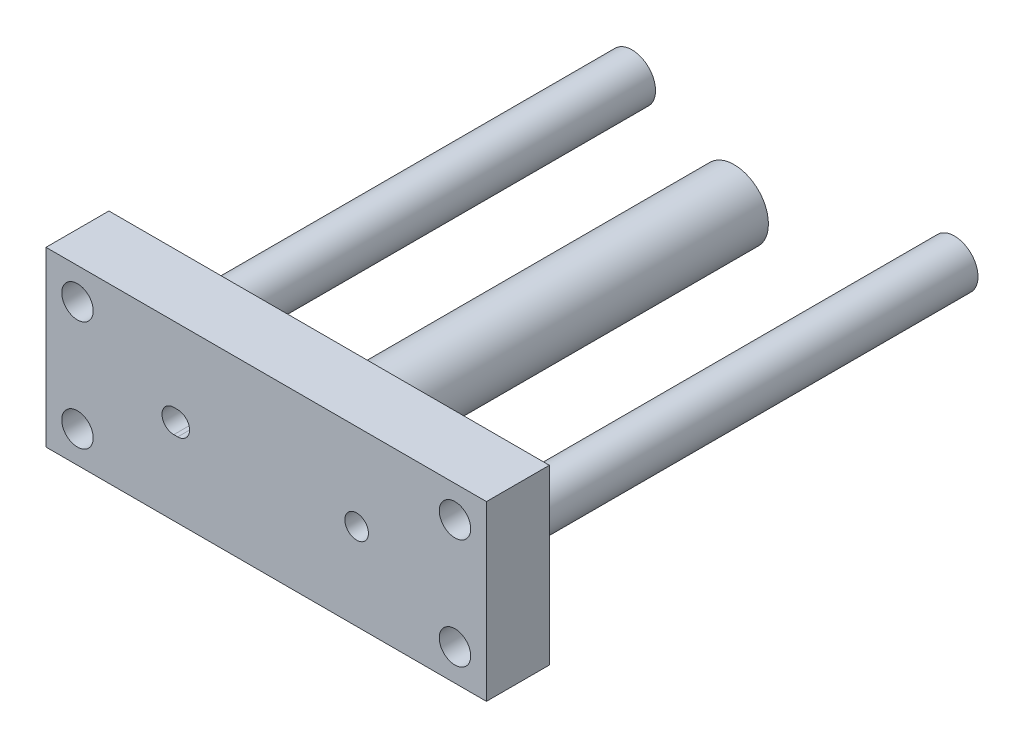
from build123d import *

# Parameters (mm, degrees)
SKETCH_4_R               = 3
EXTRUDE_1_DEPTH          = 54
CUT_EXTRUDE_1_DEPTH      = 63.657800791
SKETCH_6_R               = 4
CUT_EXTRUDE_2_DEPTH      = 4.5
SKETCH_7_R               = 2.25
CUT_EXTRUDE_3_DEPTH      = 21.5
EXTRUDE_2_DEPTH          = 54
SKETCH_9_R               = 2.5
CUT_EXTRUDE_4_DEPTH      = 5
SKETCH_10_R              = 2.5
CUT_EXTRUDE_5_DEPTH      = 5
SKETCH_11_R              = 4.35
CUT_EXTRUDE_6_DEPTH      = 46.5
SKETCH_12_R              = 1.5
CUT_EXTRUDE_7_DEPTH      = 3
SKETCH_13_R              = 1.5
EXTRUDE_4_DEPTH          = 3
SKETCH_14_R              = 1.5
CUT_EXTRUDE_8_DEPTH      = 6
CUT_EXTRUDE_9_DEPTH      = 3
EXTRUDE_START            = 5
SKETCH_16_W              = 56
SKETCH_16_H              = 22
EXTRUDE_5_DEPTH          = 8
SKETCH_18_R              = 3
EXTRUDE_6_DEPTH          = 67
SKETCH_19_R              = 4.35
EXTRUDE_7_DEPTH          = 59.5
SKETCH_20_R              = 2
CUT_EXTRUDE_10_DEPTH     = 8
MIRROR_4_COPY_1_SKETCH_R = 2
MIRROR_4_COPY_1_DEPTH    = 8
CUT_EXTRUDE_START        = -3
SKETCH_21_R              = 1.5
CUT_EXTRUDE_11_DEPTH     = 3
SKETCH_22_R              = 1.5
CUT_EXTRUDE_12_DEPTH     = 3


with BuildPart() as part:
    # 草图4 → 凸台-拉伸1 (new body)
    with BuildSketch(Plane.XY):
        Polygon((-14.75, -7), (-16.25, -7), (-16.25, -6.5), (-20.75, -6.5), (-20.75, -7), (-22.25, -7), (-22.25, -11), (-20.75, -11), (-20.75, -13), (-29, -13), (-29, 13), (-23, 13), (-20.6, 10.6), (-19.1, 10.6), (-16.7, 13), (0, 13), (0, -13), (-16.25, -13), (-16.25, -11), (-14.75, -11), align=None)
        with Locations((-20.5, 0)):
            Circle(SKETCH_4_R, mode=Mode.SUBTRACT)
    extrude(amount=-EXTRUDE_1_DEPTH)

    # 草图5 → 切除-拉伸1 (cut, through all)
    with BuildSketch(Plane.XY):
        Polygon((-5.5, -12), (-4.5, -12), (-4.5, -13), (-2.25, -13), (-2.25, -12), (-1.25, -12), (-1.25, -10), (-5.5, -10), align=None)
    cut_extrude_1 = extrude(amount=-CUT_EXTRUDE_1_DEPTH, mode=Mode.SUBTRACT)

    # 镜向1: 切除-拉伸1 across plane
    add(cut_extrude_1.mirror(Plane.ZX), mode=Mode.SUBTRACT)

    # 草图6 → 切除-拉伸2 (cut)
    with BuildSketch(Plane(origin=(0, 13, 0), x_dir=(-1, 0, 0), z_dir=(0, 1, 0))):
        with Locations(Location((11.5, -25, 0), (0, 0, 90))):
            Circle(SKETCH_6_R)
        with Locations(Location((11.5, -5, 0), (0, 0, 90))):
            Circle(SKETCH_6_R)
    extrude(amount=-CUT_EXTRUDE_2_DEPTH, mode=Mode.SUBTRACT)

    # 草图7 → 切除-拉伸3 (cut)
    with BuildSketch(Plane(origin=(0, 8.5, 0), x_dir=(1, 0, 0), z_dir=(0, 1, 0))):
        with Locations(Location((-11.5, 25, 0), (0, 0, 270))):
            Circle(SKETCH_7_R)
        with Locations(Location((-11.5, 5, 0), (0, 0, 270))):
            Circle(SKETCH_7_R)
    extrude(amount=-CUT_EXTRUDE_3_DEPTH, mode=Mode.SUBTRACT)

    # 镜向2: part across plane


with BuildPart() as part_1:
    add(part.part)
    add(part.part.mirror(Plane(origin=(0, 0, 0), x_dir=(0, 0, 1), z_dir=(1, 0, 0))))

    # 草图8 → 凸台-拉伸2 (add)
    with BuildSketch(Plane.XY):
        Polygon((16.7, 13), (23, 13), (20.6, 10.6), (19.1, 10.6), align=None)
    extrude(amount=-EXTRUDE_2_DEPTH)

    # 草图9 → 切除-拉伸4 (cut)
    with BuildSketch(Plane(origin=(0, 13, 0), x_dir=(1, 0, 0), z_dir=(0, 1, 0))):
        with Locations(Location((18, 46.5, 0), (0, 0, 270))):
            Circle(SKETCH_9_R)
        with Locations(Location((18, 11, 0), (0, 0, 270))):
            Circle(SKETCH_9_R)
    extrude(amount=-CUT_EXTRUDE_4_DEPTH, mode=Mode.SUBTRACT)

    # 草图10 → 切除-拉伸5 (cut)
    with BuildSketch(Plane(origin=(29, 0, 0), x_dir=(0, 0, -1), z_dir=(1, 0, 0))):
        with Locations((11, 8)):
            Circle(SKETCH_10_R)
        with Locations((38.5, 8)):
            Circle(SKETCH_10_R)
    extrude(amount=-CUT_EXTRUDE_5_DEPTH, mode=Mode.SUBTRACT)

    # 草图11 → 切除-拉伸6 (cut)
    with BuildSketch(Plane.XY):
        Circle(SKETCH_11_R)
    extrude(amount=-CUT_EXTRUDE_6_DEPTH, mode=Mode.SUBTRACT)

    # 草图12 → 切除-拉伸7 (cut)
    with BuildSketch(Plane(origin=(0, 0, -54), x_dir=(-1, 0, 0), z_dir=(0, 0, -1))):
        with Locations((-11.5, 0)):
            Circle(SKETCH_12_R)
        with BuildLine():
            Line((11.75, 1.5), (11.25, 1.5))
            ThreePointArc((11.25, 1.5), (9.75, 0), (11.25, -1.5))
            Line((11.25, -1.5), (11.75, -1.5))
            ThreePointArc((11.75, -1.5), (13.25, 0), (11.75, 1.5))
        make_face()
    extrude(amount=-CUT_EXTRUDE_7_DEPTH, mode=Mode.SUBTRACT)

    # 草图13 → 凸台-拉伸4 (add)
    with BuildSketch(Plane(origin=(0, 0, -51), x_dir=(-1, 0, 0), z_dir=(0, 0, -1))):
        with Locations((11.5, 0)):
            Circle(SKETCH_13_R)
        with Locations((-11.5, 0)):
            Circle(SKETCH_13_R)
    extrude(amount=-EXTRUDE_4_DEPTH)

    # 草图14 → 切除-拉伸8 (cut)
    with BuildSketch(Plane.XZ.offset(13)):
        with Locations(Location((-11.5, -15, 0), (0, 0, 270))):
            Circle(SKETCH_14_R)
        with Locations(Location((11.5, -15, 0), (0, 0, 270))):
            Circle(SKETCH_14_R)
    extrude(amount=-CUT_EXTRUDE_8_DEPTH, mode=Mode.SUBTRACT)

    # 草图15 → 切除-拉伸9 (cut)
    with BuildSketch(Plane.XZ.offset(13)):
        with BuildLine():
            Line((-11.75, -13.5), (-11.25, -13.5))
            ThreePointArc((-11.25, -13.5), (-9.75, -15), (-11.25, -16.5))
            Line((-11.25, -16.5), (-11.75, -16.5))
            ThreePointArc((-11.75, -16.5), (-13.25, -15), (-11.75, -13.5))
        make_face()
    extrude(amount=-CUT_EXTRUDE_9_DEPTH, mode=Mode.SUBTRACT)


with BuildPart() as body_2:
    # 草图16 → 凸台-拉伸5 (new body)
    with BuildSketch(Plane.XY.offset(EXTRUDE_START)):
        Rectangle(SKETCH_16_W, SKETCH_16_H)
    extrude(amount=EXTRUDE_5_DEPTH)

    # 草图18 → 凸台-拉伸6 (add)
    with BuildSketch(Plane.XY.offset(13)):
        with Locations((20.5, 0)):
            Circle(SKETCH_18_R)
        with Locations((-20.5, 0)):
            Circle(SKETCH_18_R)
    extrude(amount=-EXTRUDE_6_DEPTH)

    # 草图19 → 凸台-拉伸7 (add)
    with BuildSketch(Plane.XY.offset(13)):
        Circle(SKETCH_19_R)
    extrude(amount=-EXTRUDE_7_DEPTH)

    # 草图20 → 切除-拉伸10 (cut)
    with BuildSketch(Plane.XY.offset(13)):
        with Locations((-24, 7)):
            Circle(SKETCH_20_R)
    cut_extrude_10 = extrude(amount=-CUT_EXTRUDE_10_DEPTH, mode=Mode.SUBTRACT)

    # 镜向3: 切除-拉伸10 across plane
    add(cut_extrude_10.mirror(Plane.ZX), mode=Mode.SUBTRACT)

    # 镜向4: 切除-拉伸10 across plane
    add(cut_extrude_10.mirror(Plane(origin=(0, 0, 0), x_dir=(0, 0, 1), z_dir=(1, 0, 0))), mode=Mode.SUBTRACT)

    # 镜向4 copy 1 sketch → 镜向4 copy 1 (cut)
    with BuildSketch(Plane(origin=(0, 0, 13), x_dir=(-1, 0, 0), z_dir=(0, 0, 1))):
        with Locations((-24, 7)):
            Circle(MIRROR_4_COPY_1_SKETCH_R)
    extrude(amount=-MIRROR_4_COPY_1_DEPTH, mode=Mode.SUBTRACT)

    # 草图21 → 切除-拉伸11 (cut)
    with BuildSketch(Plane.XY.offset(13).offset(CUT_EXTRUDE_START)):
        with Locations((11.5, 0)):
            Circle(SKETCH_21_R)
        with BuildLine():
            Line((-11.75, 1.5), (-11.25, 1.5))
            ThreePointArc((-11.25, 1.5), (-9.75, 0), (-11.25, -1.5))
            Line((-11.25, -1.5), (-11.75, -1.5))
            ThreePointArc((-11.75, -1.5), (-13.25, 0), (-11.75, 1.5))
        make_face()
    extrude(amount=CUT_EXTRUDE_11_DEPTH, mode=Mode.SUBTRACT)

    # 草图22 → 切除-拉伸12 (cut)
    with BuildSketch(Plane.XY.offset(10).offset(CUT_EXTRUDE_START)):
        with Locations((-11.5, 0)):
            Circle(SKETCH_22_R)
        with Locations((11.5, 0)):
            Circle(SKETCH_22_R)
    extrude(amount=CUT_EXTRUDE_12_DEPTH, mode=Mode.SUBTRACT)


solid = body_2.part
